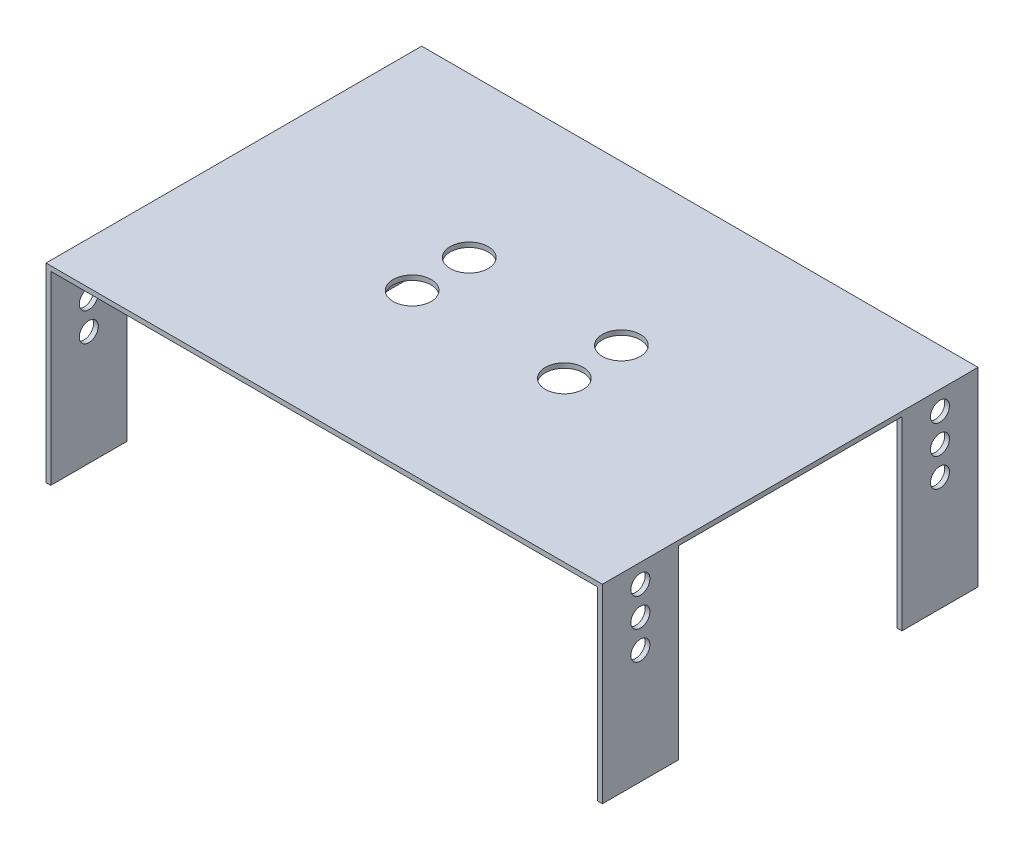
from build123d import *

# Parameters (mm, degrees)
SKETCH1_W               = 585
SKETCH1_H               = 395
SKETCH1_W_2             = 425
SKETCH1_H_2             = 235
BOSS_EXTRUDE1_DEPTH     = 2.5
SKETCH2_W               = 79.998803747
SKETCH2_H               = 200
BOSS_EXTRUDE2_DEPTH     = 5
MIRROR5_COPY_1_SKETCH_W = 79.998803747
MIRROR5_COPY_1_SKETCH_H = 200
MIRROR5_COPY_1_DEPTH    = 5
CUT_EXTRUDE2_DEPTH      = 649.257279172
CUT_EXTRUDE2_DEPTH_BACK = 649.257279172
SKETCH5_R               = 10
SKETCH7_W               = 425
SKETCH7_H               = 235
BOSS_EXTRUDE4_DEPTH     = 5
SKETCH8_R               = 20
CUT_EXTRUDE3_DEPTH      = 10


with BuildPart() as part:
    # Sketch1 → Boss-Extrude1 (new, symmetric)
    with BuildSketch(Plane(origin=(0, 0, 0), x_dir=(1, 0, 0), z_dir=(0, 1, 0))):
        with Locations((-5, 0)):
            Rectangle(SKETCH1_W, SKETCH1_H)
        with Locations((-5, 0)):
            Rectangle(SKETCH1_W_2, SKETCH1_H_2, mode=Mode.SUBTRACT)
    extrude(amount=BOSS_EXTRUDE1_DEPTH, both=True)

    # Sketch2 → Boss-Extrude2 (add)
    with BuildSketch(Plane.ZY.offset(297.5)):
        with Locations((-157.500598126, -97.5)):
            Rectangle(SKETCH2_W, SKETCH2_H)
    boss_extrude2 = extrude(amount=-BOSS_EXTRUDE2_DEPTH)

    # Mirror1: Boss-Extrude2 across plane
    add(boss_extrude2.mirror(Plane.XY))

    # Mirror5: Boss-Extrude2 across plane
    add(boss_extrude2.mirror(Plane(origin=(-5, 0, 0), x_dir=(0, 0, 1), z_dir=(1, 0, 0))))

    # Mirror5 copy 1 sketch → Mirror5 copy 1 (add)
    with BuildSketch(Plane(origin=(287.5, 0, 0), x_dir=(0, 0, -1), z_dir=(1, 0, 0))):
        with Locations((-157.500598126, -97.5)):
            Rectangle(MIRROR5_COPY_1_SKETCH_W, MIRROR5_COPY_1_SKETCH_H)
    extrude(amount=-MIRROR5_COPY_1_DEPTH)

    # Sketch5 → Cut-Extrude2 (cut, two sides: drawn at the far end of the back side and taken through both)
    with BuildSketch(Plane.ZY.offset(297.5).offset(-CUT_EXTRUDE2_DEPTH_BACK)):
        with Locations((-157.500598127, -17.5)):
            Circle(SKETCH5_R)
        with Locations((-157.500598127, -47.5)):
            Circle(SKETCH5_R)
        with Locations((-157.500598127, -77.5)):
            Circle(SKETCH5_R)
        with Locations((157.500598127, -17.5)):
            Circle(SKETCH5_R)
        with Locations((157.500598127, -47.5)):
            Circle(SKETCH5_R)
        with Locations((157.500598127, -77.5)):
            Circle(SKETCH5_R)
    extrude(amount=CUT_EXTRUDE2_DEPTH + CUT_EXTRUDE2_DEPTH_BACK, mode=Mode.SUBTRACT)

    # Sketch7 → Boss-Extrude4 (add)
    with BuildSketch(Plane(origin=(0, 2.5, 0), x_dir=(1, 0, 0), z_dir=(0, 1, 0))):
        with Locations((-5, 0)):
            Rectangle(SKETCH7_W, SKETCH7_H)
    extrude(amount=-BOSS_EXTRUDE4_DEPTH)

    # Sketch8 → Cut-Extrude3 (cut)
    with BuildSketch(Plane(origin=(0, 2.5, 0), x_dir=(1, 0, 0), z_dir=(0, 1, 0))):
        with Locations(Location((-80, 30, 0), (0, 0, 270))):
            Circle(SKETCH8_R)
        with Locations(Location((80, 30, 0), (0, 0, 270))):
            Circle(SKETCH8_R)
        with Locations(Location((80, -30, 0), (0, 0, 270))):
            Circle(SKETCH8_R)
        with Locations(Location((-80, -30, 0), (0, 0, 270))):
            Circle(SKETCH8_R)
    extrude(amount=-CUT_EXTRUDE3_DEPTH, mode=Mode.SUBTRACT)


solid = part.part
